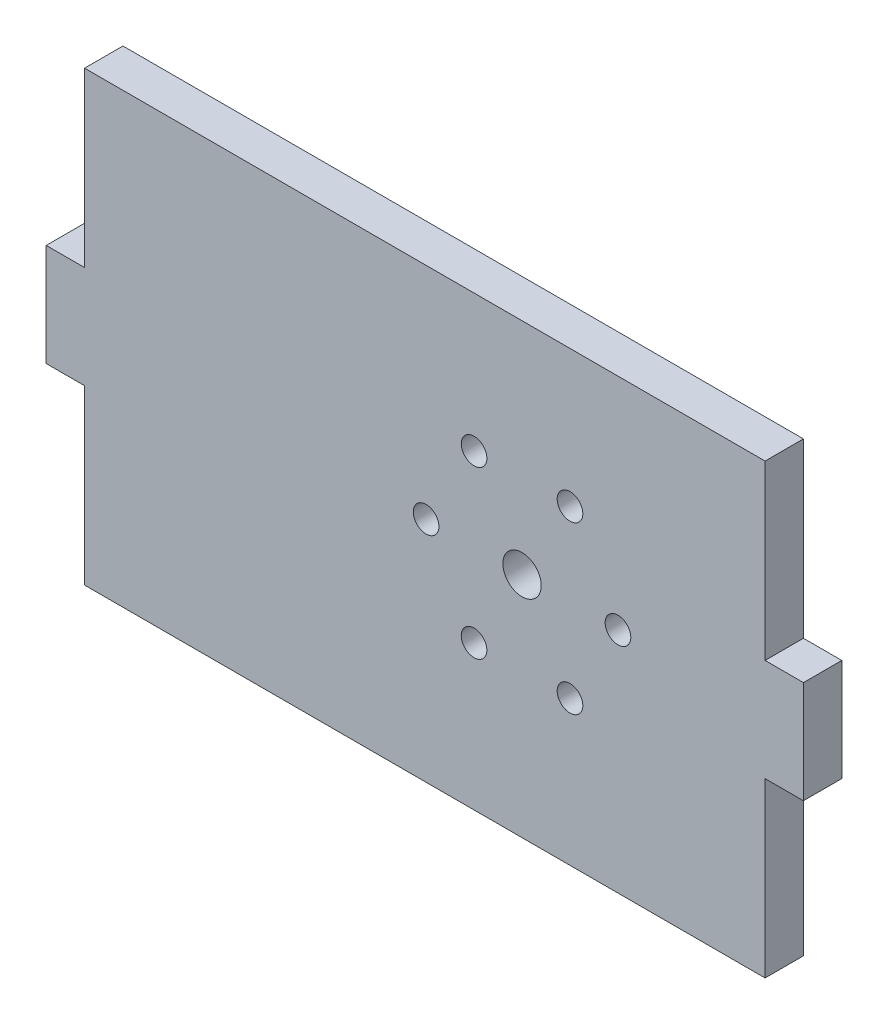
from build123d import *

# Parameters (mm, degrees)
SALIENTE_EXTRUIR1_DEPTH = 3
CORTAR_EXTRUIR1_REACH   = 36.517
CROQUIS2_R              = 1.5
CROQUIS2_R_2            = 1.002612495
CORTAR_EXTRUIR2_START   = -3
CROQUIS3_W              = 3
CROQUIS3_H              = 35
CORTAR_EXTRUIR2_DEPTH   = 3
CROQUIS4_W              = 3
CROQUIS4_H              = 8
SALIENTE_EXTRUIR2_DEPTH = 3


with BuildPart() as part:
    # Croquis1 → Saliente-Extruir1 (new body)
    with BuildSketch(Plane.XY):
        Polygon((29.6, -12.5), (26.6, -12.5), (26.6, -7.5), (29.6, -7.5), (29.6, -2.5), (26.6, -2.5), (26.6, 2.5), (29.6, 2.5), (29.6, 7.5), (26.6, 7.5), (26.6, 12.5), (29.6, 12.5), (29.6, 17.5), (-29.6, 17.5), (-29.6, 12.5), (-26.6, 12.5), (-26.6, 7.5), (-29.6, 7.5), (-29.6, 2.5), (-26.6, 2.5), (-26.6, -2.5), (-29.6, -2.5), (-29.6, -7.5), (-26.6, -7.5), (-26.6, -12.5), (-29.6, -12.5), (-29.6, -17.5), (29.6, -17.5), align=None)
    extrude(amount=SALIENTE_EXTRUIR1_DEPTH)

    # Croquis2 → Cortar-Extruir1 (cut, up to next)
    with BuildSketch(Plane(origin=(0, 0, 0), x_dir=(-1, 0, 0), z_dir=(0, 0, -1)), mode=Mode.PRIVATE) as cortar_extruir1_sk1:
        with Locations((-7.6, 0.31)):
            Circle(CROQUIS2_R)
    cortar_extruir1_tool1 = extrude(cortar_extruir1_sk1.sketch, amount=-CORTAR_EXTRUIR1_REACH, mode=Mode.PRIVATE) & part.part
    # Croquis2 → Cortar-Extruir1 (cut, up to next)
    with BuildSketch(Plane(origin=(0, 0, 0), x_dir=(-1, 0, 0), z_dir=(0, 0, -1)), mode=Mode.PRIVATE) as cortar_extruir1_sk2:
        with Locations((-15.1, 0.31)):
            Circle(CROQUIS2_R_2)
    cortar_extruir1_tool2 = extrude(cortar_extruir1_sk2.sketch, amount=-CORTAR_EXTRUIR1_REACH, mode=Mode.PRIVATE) & part.part
    # Croquis2 → Cortar-Extruir1 (cut, up to next)
    with BuildSketch(Plane(origin=(0, 0, 0), x_dir=(-1, 0, 0), z_dir=(0, 0, -1)), mode=Mode.PRIVATE) as cortar_extruir1_sk3:
        with Locations((-11.35, 6.805190528)):
            Circle(CROQUIS2_R_2)
    cortar_extruir1_tool3 = extrude(cortar_extruir1_sk3.sketch, amount=-CORTAR_EXTRUIR1_REACH, mode=Mode.PRIVATE) & part.part
    # Croquis2 → Cortar-Extruir1 (cut, up to next)
    with BuildSketch(Plane(origin=(0, 0, 0), x_dir=(-1, 0, 0), z_dir=(0, 0, -1)), mode=Mode.PRIVATE) as cortar_extruir1_sk4:
        with Locations((-3.85, 6.805190528)):
            Circle(CROQUIS2_R_2)
    cortar_extruir1_tool4 = extrude(cortar_extruir1_sk4.sketch, amount=-CORTAR_EXTRUIR1_REACH, mode=Mode.PRIVATE) & part.part
    # Croquis2 → Cortar-Extruir1 (cut, up to next)
    with BuildSketch(Plane(origin=(0, 0, 0), x_dir=(-1, 0, 0), z_dir=(0, 0, -1)), mode=Mode.PRIVATE) as cortar_extruir1_sk5:
        with Locations((-0.1, 0.31)):
            Circle(CROQUIS2_R_2)
    cortar_extruir1_tool5 = extrude(cortar_extruir1_sk5.sketch, amount=-CORTAR_EXTRUIR1_REACH, mode=Mode.PRIVATE) & part.part
    # Croquis2 → Cortar-Extruir1 (cut, up to next)
    with BuildSketch(Plane(origin=(0, 0, 0), x_dir=(-1, 0, 0), z_dir=(0, 0, -1)), mode=Mode.PRIVATE) as cortar_extruir1_sk6:
        with Locations((-3.85, -6.185190528)):
            Circle(CROQUIS2_R_2)
    cortar_extruir1_tool6 = extrude(cortar_extruir1_sk6.sketch, amount=-CORTAR_EXTRUIR1_REACH, mode=Mode.PRIVATE) & part.part
    # Croquis2 → Cortar-Extruir1 (cut, up to next)
    with BuildSketch(Plane(origin=(0, 0, 0), x_dir=(-1, 0, 0), z_dir=(0, 0, -1)), mode=Mode.PRIVATE) as cortar_extruir1_sk7:
        with Locations((-11.35, -6.185190528)):
            Circle(CROQUIS2_R_2)
    cortar_extruir1_tool7 = extrude(cortar_extruir1_sk7.sketch, amount=-CORTAR_EXTRUIR1_REACH, mode=Mode.PRIVATE) & part.part
    add(cortar_extruir1_tool1.solids().sort_by_distance((7.6, 0.31, 0))[0], mode=Mode.SUBTRACT)
    add(cortar_extruir1_tool2.solids().sort_by_distance((15.1, 0.31, 0))[0], mode=Mode.SUBTRACT)
    add(cortar_extruir1_tool3.solids().sort_by_distance((11.35, 6.805191, 0))[0], mode=Mode.SUBTRACT)
    add(cortar_extruir1_tool4.solids().sort_by_distance((3.85, 6.805191, 0))[0], mode=Mode.SUBTRACT)
    add(cortar_extruir1_tool5.solids().sort_by_distance((0.1, 0.31, 0))[0], mode=Mode.SUBTRACT)
    add(cortar_extruir1_tool6.solids().sort_by_distance((3.85, -6.185191, 0))[0], mode=Mode.SUBTRACT)
    add(cortar_extruir1_tool7.solids().sort_by_distance((11.35, -6.185191, 0))[0], mode=Mode.SUBTRACT)

    # Croquis3 → Cortar-Extruir2 (cut)
    with BuildSketch(Plane.XY.offset(3).offset(CORTAR_EXTRUIR2_START)):
        with Locations((-28.1, 0)):
            Rectangle(CROQUIS3_W, CROQUIS3_H)
        with Locations((28.1, 0)):
            Rectangle(CROQUIS3_W, CROQUIS3_H)
    extrude(amount=CORTAR_EXTRUIR2_DEPTH, mode=Mode.SUBTRACT)

    # Croquis4 → Saliente-Extruir2 (add)
    with BuildSketch(Plane.XY.offset(3)):
        with Locations((28.1, 0)):
            Rectangle(CROQUIS4_W, CROQUIS4_H)
        with Locations((-28.1, 0)):
            Rectangle(CROQUIS4_W, CROQUIS4_H)
    extrude(amount=-SALIENTE_EXTRUIR2_DEPTH)


solid = part.part
